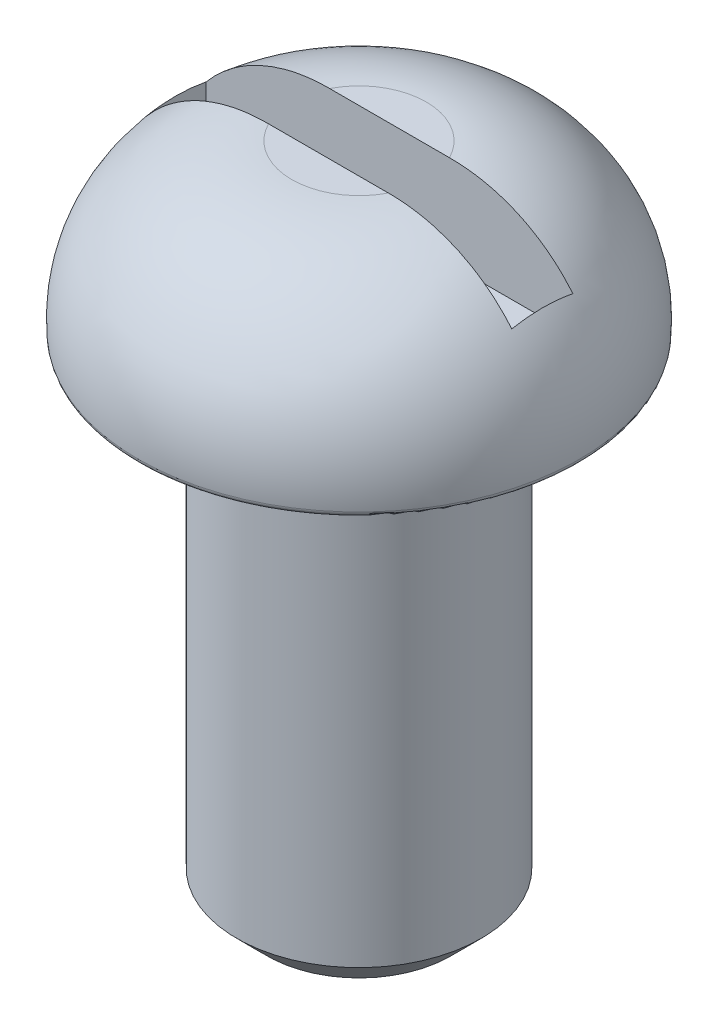
from build123d import *

# Parameters (mm, degrees)
FILLET_1_R          = 0.1
SKETCH_3_W          = 6
SKETCH_3_H          = 1
CUT_EXTRUDE_2_DEPTH = 1.5


with BuildPart() as part:
    # Эскиз1 → Повернуть1 (revolve)
    with BuildSketch(Plane.XY):
        with BuildLine():
            Line((3.6, 8), (2, 8))
            Line((2, 8), (2, 0.5))
            Line((2, 0.5), (1.5, 0))
            Line((1.5, 0), (0, 0))
            Line((0, 0), (0, 10.8))
            Line((0, 10.8), (1.1, 10.8))
            ThreePointArc((1.1, 10.8), (2.976832438, 9.95967182), (3.6, 8))
        make_face()
    revolve(axis=Axis((0, 0, 0), (0, 1, 0)))

    # Скругление1
    fillet_1_edges = [part.edges().sort_by_distance(p)[0] for p in [
        (-3.6, 8, 0),
    ]]
    fillet(fillet_1_edges, radius=FILLET_1_R)

    # Эскиз3 → Вырез-Вытянуть2 (cut)
    with BuildSketch(Plane(origin=(0, 10.8, 0), x_dir=(-1, 0, 0), z_dir=(0, 1, 0))):
        Rectangle(SKETCH_3_W, SKETCH_3_H)
    extrude(amount=-CUT_EXTRUDE_2_DEPTH, mode=Mode.SUBTRACT)


solid = part.part
